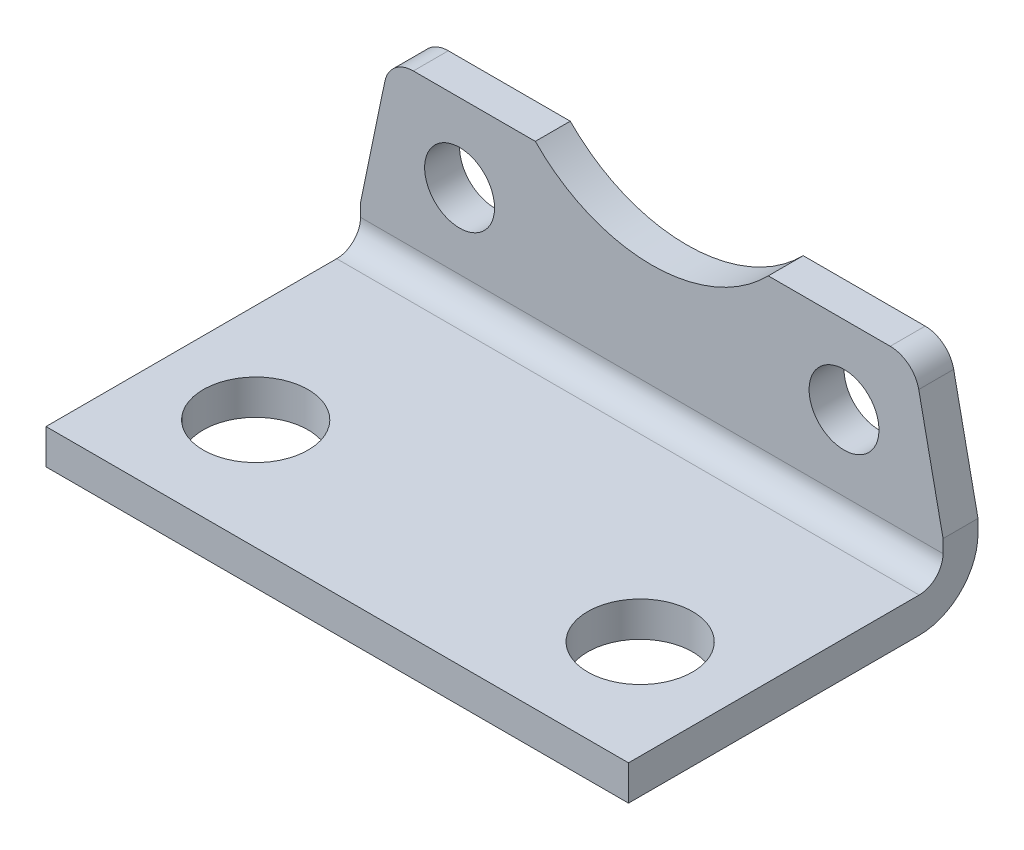
from build123d import *

# Parameters (mm, degrees)
EXTRUDE_START          = 25
EXTRUDE_1_DEPTH        = 50
SKETCH_4_R             = 4.5
CUT_EXTRUDE_1_DEPTH    = 85.274847968
SKETCH_6_R             = 3
CUT_EXTRUDE_2_DEPTH    = 47.238512087
SKETCH_7_R             = 14
CUT_EXTRUDE_3_DEPTH    = 47.238512087
SKETCH_9_W             = 50
SKETCH_9_H             = 9.8
CUT_EXTRUDE_4_DEPTH    = 47.238512087
CUT_EXTRUDE_1983_DEPTH = 42.051674753
FILLET_1_R             = 2.5


with BuildPart() as part:
    # 草图3 → 凸台-拉伸1 (new body)
    with BuildSketch(Plane(origin=(0, 0, 0), x_dir=(0, 0, -1), z_dir=(1, 0, 0)).offset(EXTRUDE_START)):
        with BuildLine():
            Line((-76.5, 0), (-76.5, 3))
            Line((-76.5, 3), (-51.55, 3))
            ThreePointArc((-51.55, 3), (-50.100431099, 3.600431099), (-49.5, 5.05))
            Line((-49.5, 5.05), (-49.5, 28))
            Line((-49.5, 28), (-46.5, 28))
            Line((-46.5, 28), (-46.5, 5.05))
            ThreePointArc((-46.5, 5.05), (-47.979110755, 1.479110755), (-51.55, 0))
            Line((-51.55, 0), (-76.5, 0))
        make_face()
    extrude(amount=-EXTRUDE_1_DEPTH)

    # 草图4 → 切除-拉伸1 (cut, through all)
    with BuildSketch(Plane(origin=(0, 3, 0), x_dir=(1, 0, 0), z_dir=(0, 1, 0))):
        with Locations(Location((-16.5, -67, 0), (0, 0, 270))):
            Circle(SKETCH_4_R)
    cut_extrude_1 = extrude(amount=-CUT_EXTRUDE_1_DEPTH, mode=Mode.SUBTRACT)

    # 镜向1: 切除-拉伸1 across plane
    add(cut_extrude_1.mirror(Plane(origin=(0, 0, 0), x_dir=(0, 0, 1), z_dir=(1, 0, 0))), mode=Mode.SUBTRACT)

    # 草图6 → 切除-拉伸2 (cut, through all)
    with BuildSketch(Plane.XY.offset(49.5)):
        with Locations((-16.5, 11.5)):
            Circle(SKETCH_6_R)
    cut_extrude_2 = extrude(amount=-CUT_EXTRUDE_2_DEPTH, mode=Mode.SUBTRACT)

    # 镜向2: 切除-拉伸2 across plane
    add(cut_extrude_2.mirror(Plane(origin=(0, 0, 0), x_dir=(0, 0, 1), z_dir=(1, 0, 0))), mode=Mode.SUBTRACT)

    # 草图7 → 切除-拉伸3 (cut, through all)
    with BuildSketch(Plane.XY.offset(49.5)):
        with Locations((0, 28)):
            Circle(SKETCH_7_R)
    extrude(amount=-CUT_EXTRUDE_3_DEPTH, mode=Mode.SUBTRACT)

    # 草图9 → 切除-拉伸4 (cut, through all)
    with BuildSketch(Plane.XY.offset(49.5)):
        with Locations((0, 23.1)):
            Rectangle(SKETCH_9_W, SKETCH_9_H)
    extrude(amount=-CUT_EXTRUDE_4_DEPTH, mode=Mode.SUBTRACT)

    # 草图8 → Cut-Extrude 1983 (cut, through all)
    with BuildSketch(Plane.XY.offset(49.5)):
        Polygon((-22.5, 18.2), (22.5, 18.2), (25, 6.17), (25, 28), (-25, 28), (-25, 6.17), align=None)
    extrude(amount=-CUT_EXTRUDE_1983_DEPTH, mode=Mode.SUBTRACT)

    # 圆角1
    fillet_1_edges = [part.edges().sort_by_distance(p)[0] for p in [
        (22.5, 18.2, 48),
        (-22.5, 18.2, 48),
    ]]
    fillet(fillet_1_edges, radius=FILLET_1_R)


solid = part.part
